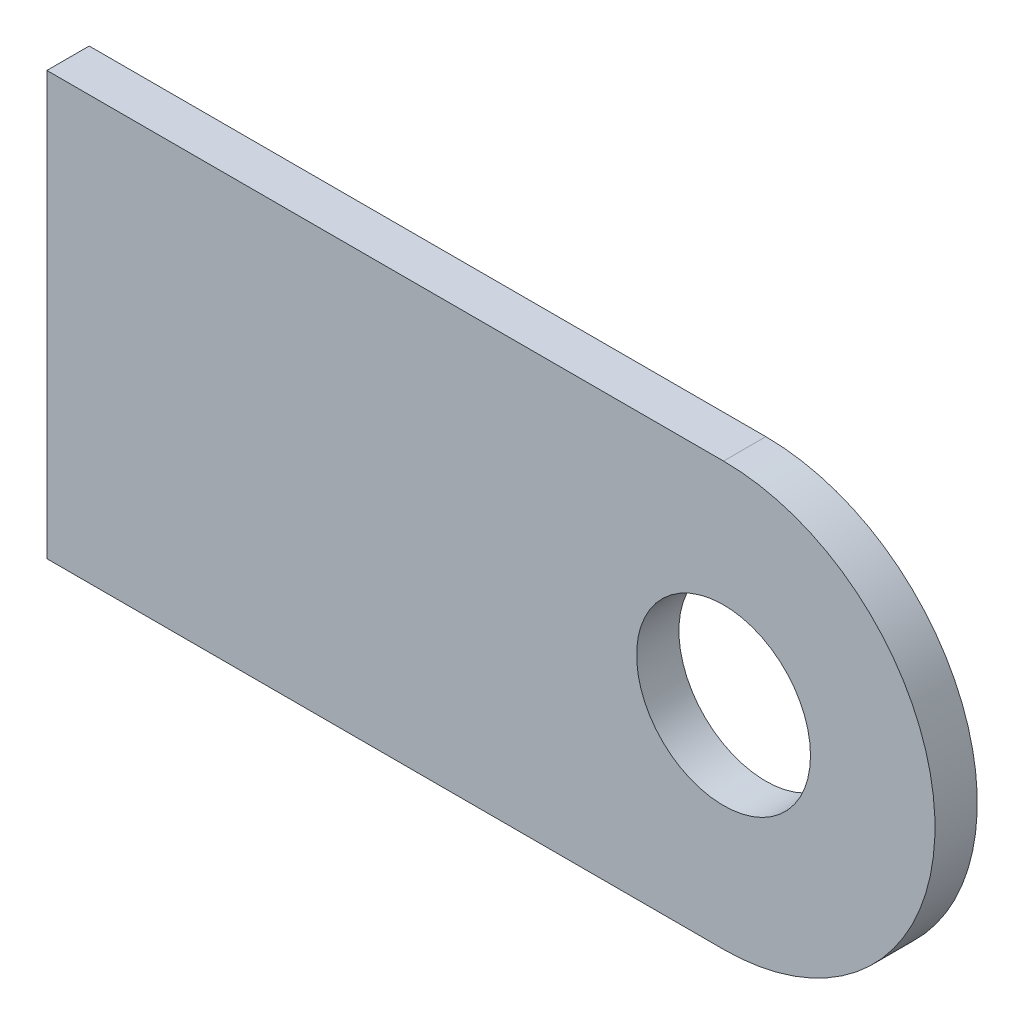
from build123d import *

# Parameters (mm, degrees)
SKETCH1_R           = 3.2639
BOSS_EXTRUDE1_DEPTH = 1.5875


with BuildPart() as part:
    # Sketch1 → Boss-Extrude1 (new body)
    with BuildSketch(Plane.XY):
        with BuildLine():
            Line((0, 15.875), (25.4, 15.875))
            ThreePointArc((25.4, 15.875), (33.3375, 7.9375), (25.4, 0))
            Line((25.4, 0), (0, 0))
            Line((0, 0), (0, 15.875))
        make_face()
        with Locations((25.4, 7.9375)):
            Circle(SKETCH1_R, mode=Mode.SUBTRACT)
    extrude(amount=BOSS_EXTRUDE1_DEPTH)


solid = part.part
